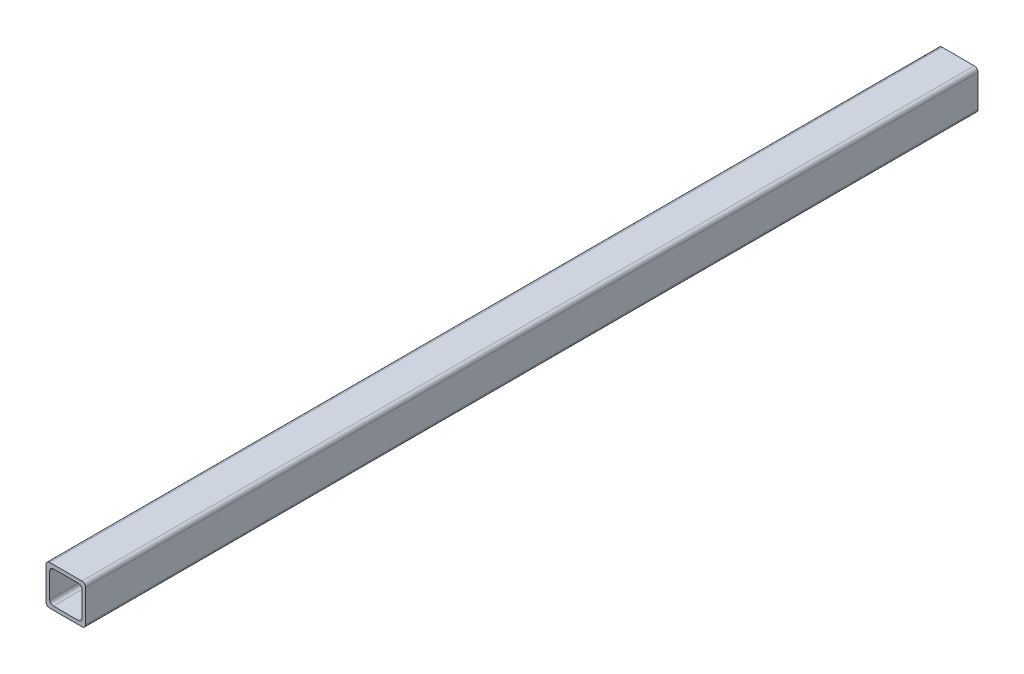
from build123d import *

# Parameters (mm, degrees)
BOSS_EXTRUDE1_DEPTH = 609.6


with BuildPart() as part:
    # Sketch1 → Boss-Extrude1 (new body)
    with BuildSketch(Plane.XY):
        with BuildLine():
            Line((-11, -13.54), (11, -13.54))
            ThreePointArc((11, -13.54), (12.796051224, -12.796051224), (13.54, -11))
            Line((13.54, -11), (13.54, 11))
            ThreePointArc((13.54, 11), (12.796051224, 12.796051224), (11, 13.54))
            Line((11, 13.54), (-11, 13.54))
            ThreePointArc((-11, 13.54), (-12.796051224, 12.796051224), (-13.54, 11))
            Line((-13.54, 11), (-13.54, -11))
            ThreePointArc((-13.54, -11), (-12.796051224, -12.796051224), (-11, -13.54))
        make_face()
        with BuildLine():
            Line((-8.46, -11), (8.46, -11))
            ThreePointArc((8.46, -11), (10.256051224, -10.256051224), (11, -8.46))
            Line((11, -8.46), (11, 8.46))
            ThreePointArc((11, 8.46), (10.256051224, 10.256051224), (8.46, 11))
            Line((8.46, 11), (-8.46, 11))
            ThreePointArc((-8.46, 11), (-10.256051224, 10.256051224), (-11, 8.46))
            Line((-11, 8.46), (-11, -8.46))
            ThreePointArc((-11, -8.46), (-10.256051224, -10.256051224), (-8.46, -11))
        make_face(mode=Mode.SUBTRACT)
    extrude(amount=BOSS_EXTRUDE1_DEPTH)


solid = part.part
